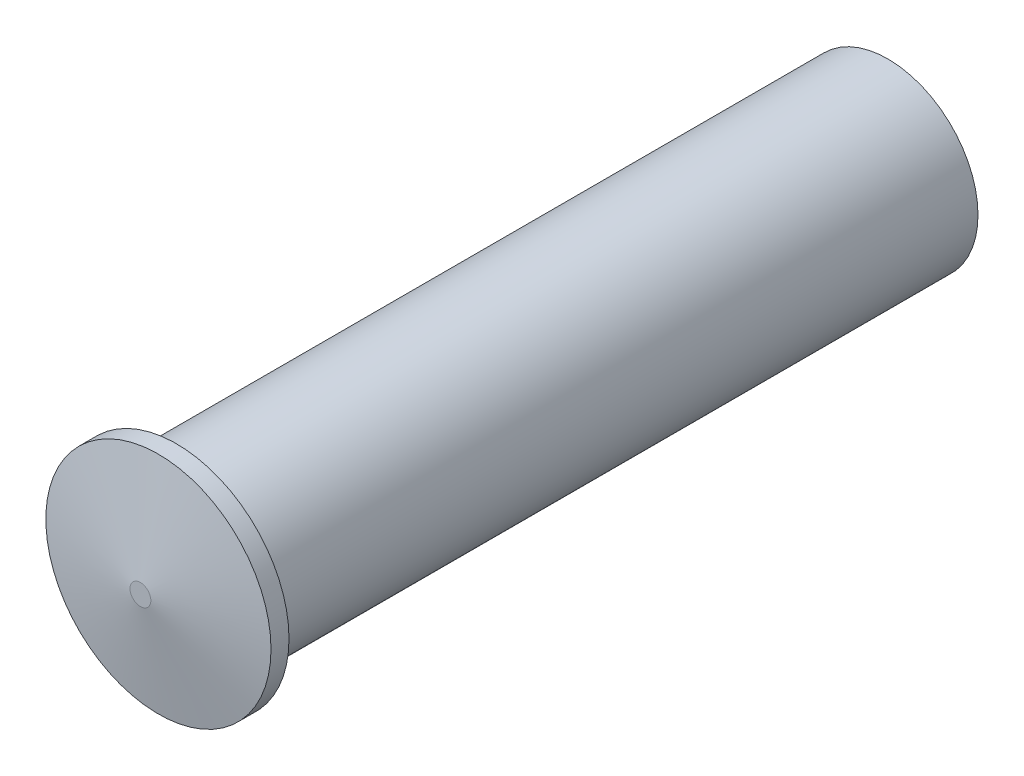
from build123d import *

# Parameters (mm, degrees)
SKETCH1_R           = 10
BOSS_EXTRUDE2_DEPTH = 79
SKETCH5_R           = 12.5
BOSS_EXTRUDE3_DEPTH = 2
SKETCH6_R           = 12.5
BOSS_EXTRUDE4_DEPTH = 2
BOSS_EXTRUDE4_TAPER = 80
SKETCH7_R           = 8
CUT_EXTRUDE1_DEPTH  = 79


with BuildPart() as part:
    # Sketch1 → Boss-Extrude2 (new body)
    with BuildSketch(Plane.XY):
        Circle(SKETCH1_R)
    extrude(amount=-BOSS_EXTRUDE2_DEPTH)

    # Sketch5 → Boss-Extrude3 (add)
    with BuildSketch(Plane.XY):
        Circle(SKETCH5_R)
    extrude(amount=BOSS_EXTRUDE3_DEPTH)

    # Sketch6 → Boss-Extrude4 (add)
    with BuildSketch(Plane.XY.offset(2)):
        Circle(SKETCH6_R)
    extrude(amount=BOSS_EXTRUDE4_DEPTH, taper=BOSS_EXTRUDE4_TAPER)

    # Sketch7 → Cut-Extrude1 (cut)
    with BuildSketch(Plane(origin=(0, 0, -79), x_dir=(-1, 0, 0), z_dir=(0, 0, -1))):
        Circle(SKETCH7_R)
    extrude(amount=-CUT_EXTRUDE1_DEPTH, mode=Mode.SUBTRACT)


solid = part.part
